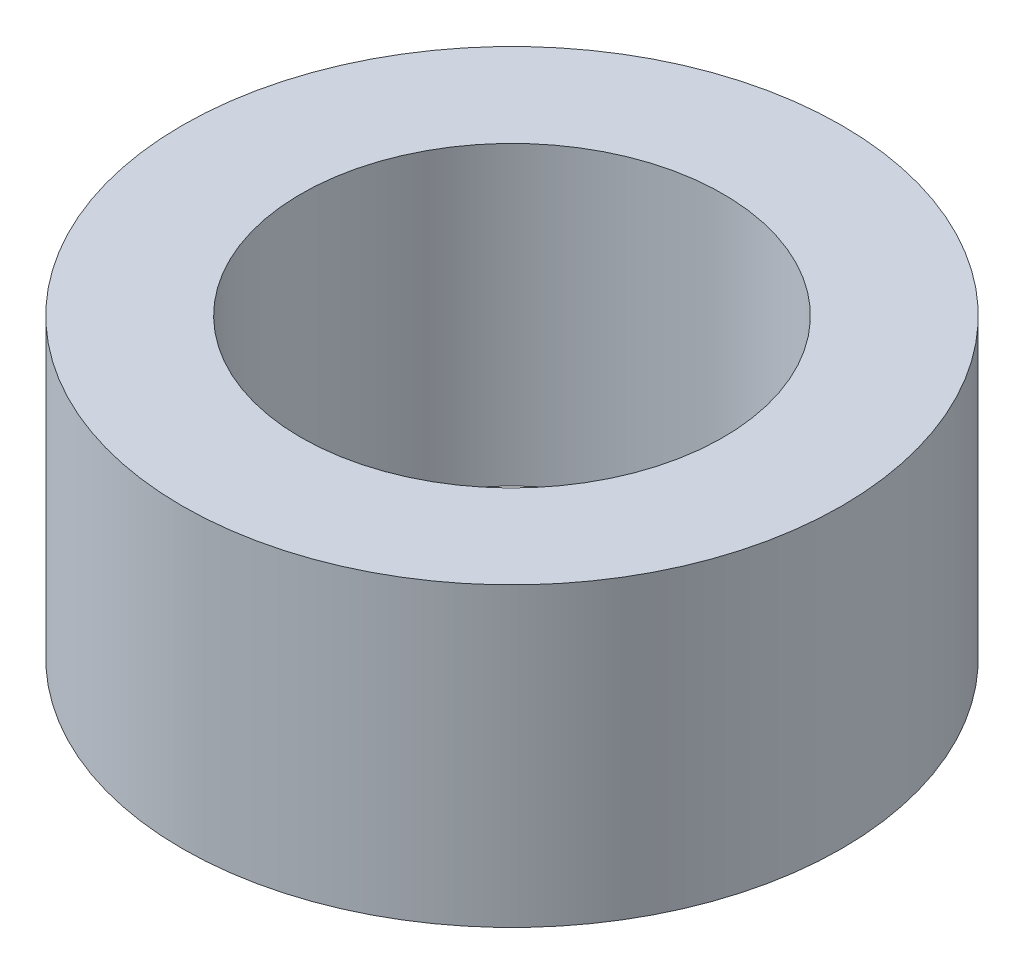
from build123d import *

# Parameters (mm, degrees)
SKETCH_1_R      = 5
SKETCH_1_R_2    = 3.2
EXTRUDE_1_DEPTH = 4.5


with BuildPart() as part:
    # 草图1 → 凸台-拉伸1 (new body)
    with BuildSketch(Plane(origin=(0, 0, 0), x_dir=(1, 0, 0), z_dir=(0, 1, 0))):
        with Locations(Location((0, 0, 0), (0, 0, 270))):
            Circle(SKETCH_1_R)
        with Locations(Location((0, 0, 0), (0, 0, 270))):
            Circle(SKETCH_1_R_2, mode=Mode.SUBTRACT)
    extrude(amount=EXTRUDE_1_DEPTH)


solid = part.part
